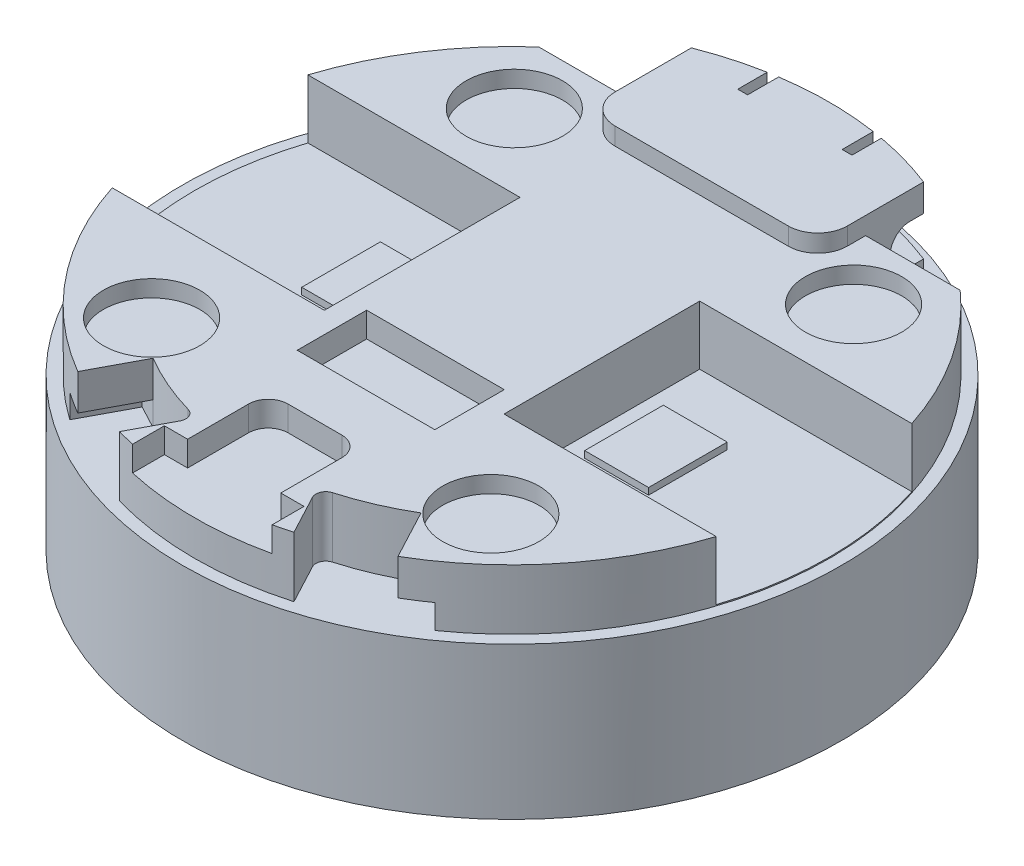
from build123d import *

# Parameters (mm, degrees)
SKETCH1_R           = 33.52
BOSS_EXTRUDE1_DEPTH = 9
SKETCH2_R           = 32.29
BOSS_EXTRUDE2_DEPTH = 6.12
CUT_EXTRUDE1_START  = -6
CUT_EXTRUDE1_DEPTH  = 6
SKETCH10_R          = 2
CUT_EXTRUDE2_DEPTH  = 59.369629946
SKETCH23_W          = 6.054526745
SKETCH23_H          = 4
CUT_EXTRUDE3_DEPTH  = 59.369629972
BOSS_EXTRUDE4_DEPTH = 1.78
CUT_EXTRUDE5_START  = -6
CUT_EXTRUDE5_DEPTH  = 6
CUT_EXTRUDE6_START  = -2.54
SKETCH26_W          = 14
SKETCH26_H          = 4.621469047
CUT_EXTRUDE6_DEPTH  = 2.54
CUT_EXTRUDE7_START  = -6.12
CUT_EXTRUDE7_DEPTH  = 6.12
SKETCH26_7_R        = 4.9
CUT_EXTRUDE8_DEPTH  = 1.7
SKETCH37_W          = 5.66557495
SKETCH37_H          = 2.46
CUT_EXTRUDE13_DEPTH = 2.7
SKETCH30_W          = 5.66557495
SKETCH30_H          = 2.46
CUT_EXTRUDE14_DEPTH = 2.7
SKETCH40_W          = 6.5
SKETCH40_H          = 8
BOSS_EXTRUDE5_DEPTH = 0.68
CUT_EXTRUDE15_START = -4.1
CUT_EXTRUDE15_DEPTH = 4.1
BOSS_EXTRUDE6_START = 6.44
SKETCH41_R          = 33.52
BOSS_EXTRUDE6_DEPTH = 6.44
SKETCH43_W          = 14
SKETCH43_H          = 2.54
CUT_EXTRUDE16_DEPTH = 2.44
FILLET1_R           = 1
FILLET2_R           = 1


with BuildPart() as part:
    # Sketch1 → Boss-Extrude1 (new body)
    with BuildSketch(Plane(origin=(0, 0, 0), x_dir=(1, 0, 0), z_dir=(0, 1, 0))):
        with Locations(Location((0, 0, 0), (0, 0, 270))):
            Circle(SKETCH1_R)
    extrude(amount=BOSS_EXTRUDE1_DEPTH)

    # Sketch2 → Boss-Extrude2 (add)
    with BuildSketch(Plane(origin=(0, 9, 0), x_dir=(1, 0, 0), z_dir=(0, 1, 0))):
        with Locations(Location((0, 0, 0), (0, 0, 270))):
            Circle(SKETCH2_R)
    extrude(amount=BOSS_EXTRUDE2_DEPTH)

    # Sketch3 → Cut-Extrude1 (cut)
    with BuildSketch(Plane(origin=(0, 15.12, 0), x_dir=(1, 0, 0), z_dir=(0, 1, 0)).offset(CUT_EXTRUDE1_START)):
        with BuildLine():
            Line((-11.81, 24.153658108), (-11.81, 30.052753618))
            ThreePointArc((-11.81, 30.052753618), (-16.879698811, 27.5267119), (-21.43, 24.153658108))
            Line((-21.43, 24.153658108), (-11.81, 24.153658108))
        make_face()
        with BuildLine():
            ThreePointArc((21.43, 24.153658108), (16.879698811, 27.5267119), (11.81, 30.052753618))
            Line((11.81, 30.052753618), (11.81, 24.153658108))
            Line((11.81, 24.153658108), (21.43, 24.153658108))
        make_face()
    extrude(amount=CUT_EXTRUDE1_DEPTH, mode=Mode.SUBTRACT)

    # Sketch10 → Cut-Extrude2 (cut, through all)
    with BuildSketch(Plane.ZY.offset(11.81)):
        with Locations(Location((-28.653658108, 12.12, 0), (0, 0, 134.390731556))):
            Circle(SKETCH10_R)
    extrude(amount=-CUT_EXTRUDE2_DEPTH, mode=Mode.SUBTRACT)

    # Sketch23 → Cut-Extrude3 (cut, through all)
    with BuildSketch(Plane.ZY.offset(11.81)):
        with Locations((-31.680921481, 12.12)):
            Rectangle(SKETCH23_W, SKETCH23_H)
    extrude(amount=-CUT_EXTRUDE3_DEPTH, mode=Mode.SUBTRACT)

    # Sketch24 → Boss-Extrude4 (add)
    with BuildSketch(Plane(origin=(0, 15.12, 0), x_dir=(1, 0, 0), z_dir=(0, 1, 0))):
        with BuildLine():
            ThreePointArc((0, 32.29), (-6.010020203, 31.725758575), (-11.81, 30.052753618))
            Line((-11.81, 30.052753618), (-11.81, 24.153658108))
            Line((-11.81, 24.153658108), (-11.81, 22.29))
            ThreePointArc((-11.81, 22.29), (-10.931320344, 20.168679656), (-8.81, 19.29))
            Line((-8.81, 19.29), (0, 19.29))
            Line((0, 19.29), (0, 32.29))
        make_face()
        with BuildLine():
            ThreePointArc((11.81, 30.052753618), (6.010020203, 31.725758575), (0, 32.29))
            Line((0, 32.29), (0, 19.29))
            Line((0, 19.29), (8.81, 19.29))
            ThreePointArc((8.81, 19.29), (10.931320344, 20.168679656), (11.81, 22.29))
            Line((11.81, 22.29), (11.81, 24.153658108))
            Line((11.81, 24.153658108), (11.81, 30.052753618))
        make_face()
    extrude(amount=BOSS_EXTRUDE4_DEPTH)

    # Sketch26<4> → Cut-Extrude5 (cut)
    with BuildSketch(Plane(origin=(0, 15.12, 0), x_dir=(1, 0, 0), z_dir=(0, 1, 0)).offset(CUT_EXTRUDE5_START)):
        with BuildLine():
            ThreePointArc((30.718749975, -9.95), (32.29, 0), (30.718749975, 9.95))
            Line((30.718749975, 9.95), (9.138749975, 9.95))
            Line((9.138749975, 9.95), (9.138749975, -9.95))
            Line((9.138749975, -9.95), (30.718749975, -9.95))
        make_face()
    cut_extrude5 = extrude(amount=CUT_EXTRUDE5_DEPTH, mode=Mode.SUBTRACT)

    # Sketch26 → Cut-Extrude6 (cut)
    with BuildSketch(Plane(origin=(0, 15.12, 0), x_dir=(1, 0, 0), z_dir=(0, 1, 0)).offset(CUT_EXTRUDE6_START)):
        with BuildLine():
            ThreePointArc((-7.1, -31.499747618), (0, -32.29), (7.1, -31.499747618))
            Line((7.1, -31.499747618), (7.1, -28.259676136))
            Line((7.1, -28.259676136), (4.74, -28.259676136))
            Line((4.74, -28.259676136), (4.74, -26.204757202))
            Line((4.74, -26.204757202), (4.74, -22.05))
            ThreePointArc((4.74, -22.05), (4.154213562, -20.635786438), (2.74, -20.05))
            Line((2.74, -20.05), (-2.74, -20.05))
            ThreePointArc((-2.74, -20.05), (-4.154213562, -20.635786438), (-4.74, -22.05))
            Line((-4.74, -22.05), (-4.74, -26.204757202))
            Line((-4.74, -26.204757202), (-4.74, -28.259676136))
            Line((-4.74, -28.259676136), (-7.1, -28.259676136))
            Line((-7.1, -28.259676136), (-7.1, -31.499747618))
        make_face()
        with Locations((0, -12.539265477)):
            Rectangle(SKETCH26_W, SKETCH26_H)
    extrude(amount=CUT_EXTRUDE6_DEPTH, mode=Mode.SUBTRACT)

    # Sketch28 → Cut-Extrude7 (cut)
    with BuildSketch(Plane(origin=(0, 15.12, 0), x_dir=(1, 0, 0), z_dir=(0, 1, 0)).offset(CUT_EXTRUDE7_START)):
        with BuildLine():
            ThreePointArc((-6.138643472, -25.91281452), (-9.99763899, -24.682060583), (-13.62533551, -22.880278238))
            Line((-13.62533551, -22.880278238), (-16.282957683, -27.883855348))
            ThreePointArc((-16.282957683, -27.883855348), (-12.673955944, -29.698736349), (-8.866590913, -31.048794913))
            Line((-8.866590913, -31.048794913), (-6.138643472, -25.91281452))
        make_face()
        with BuildLine():
            ThreePointArc((13.62533551, -22.880278238), (9.99763899, -24.682060583), (6.138643472, -25.91281452))
            Line((6.138643472, -25.91281452), (8.866590913, -31.048794913))
            ThreePointArc((8.866590913, -31.048794913), (12.673955944, -29.698736349), (16.282957683, -27.883855348))
            Line((16.282957683, -27.883855348), (13.62533551, -22.880278238))
        make_face()
    extrude(amount=CUT_EXTRUDE7_DEPTH, mode=Mode.SUBTRACT)

    # Sketch26<7> → Cut-Extrude8 (cut)
    with BuildSketch(Plane(origin=(0, 15.12, 0), x_dir=(1, 0, 0), z_dir=(0, 1, 0))):
        with Locations(Location((17.253376134, 17.489232673, 0), (0, 0, 270))):
            Circle(SKETCH26_7_R)
        with Locations(Location((17.253376134, -19.410767327, 0), (0, 0, 270))):
            Circle(SKETCH26_7_R)
        with Locations(Location((-17.253376134, -19.410767327, 0), (0, 0, 270))):
            Circle(SKETCH26_7_R)
        with Locations(Location((-17.253376134, 17.489232673, 0), (0, 0, 270))):
            Circle(SKETCH26_7_R)
    extrude(amount=-CUT_EXTRUDE8_DEPTH, mode=Mode.SUBTRACT)

    # Sketch37 → Cut-Extrude13 (cut)
    with BuildSketch(Plane(origin=(1.148573691, 0, -0.610058532), x_dir=(0.4690825196866177, 0, 0.8831543408286312), z_dir=(-0.8831543408286312, 0, 0.4690825196866177))):
        with Locations((29.431011233, 10.23)):
            Rectangle(SKETCH37_W, SKETCH37_H)
    extrude(amount=-CUT_EXTRUDE13_DEPTH, mode=Mode.SUBTRACT)

    # Sketch30 → Cut-Extrude14 (cut)
    with BuildSketch(Plane(origin=(-1.148573691, 0, -0.610058532), x_dir=(0.4690825196866177, 0, -0.8831543408286312), z_dir=(0.8831543408286312, 0, 0.4690825196866177))):
        with Locations((-29.431011233, 10.23)):
            Rectangle(SKETCH30_W, SKETCH30_H)
    extrude(amount=-CUT_EXTRUDE14_DEPTH, mode=Mode.SUBTRACT)

    # Sketch40 → Boss-Extrude5 (add)
    with BuildSketch(Plane(origin=(0, 9.12, 0), x_dir=(1, 0, 0), z_dir=(0, 1, 0))):
        with Locations((14.388749975, 0.25)):
            Rectangle(SKETCH40_W, SKETCH40_H)
    boss_extrude5 = extrude(amount=BOSS_EXTRUDE5_DEPTH)

    # Sketch31 → Cut-Extrude15 (cut)
    with BuildSketch(Plane(origin=(0, 16.9, 0), x_dir=(1, 0, 0), z_dir=(0, 1, 0)).offset(CUT_EXTRUDE15_START)):
        with BuildLine():
            ThreePointArc((-4.81, 31.929735358), (-5.310654422, 31.850291201), (-5.81, 31.76299734))
            Line((-5.81, 31.76299734), (-5.81, 28.77))
            Line((-5.81, 28.77), (-4.81, 28.77))
            Line((-4.81, 28.77), (-4.81, 31.929735358))
        make_face()
        with BuildLine():
            ThreePointArc((5.81, 31.76299734), (5.310654422, 31.850291201), (4.81, 31.929735358))
            Line((4.81, 31.929735358), (4.81, 28.77))
            Line((4.81, 28.77), (5.81, 28.77))
            Line((5.81, 28.77), (5.81, 31.76299734))
        make_face()
    extrude(amount=CUT_EXTRUDE15_DEPTH, mode=Mode.SUBTRACT)

    # Sketch41 → Boss-Extrude6 (add)
    with BuildSketch(Plane.XZ.offset(BOSS_EXTRUDE6_START)):
        with Locations(Location((0, 0, 0), (0, 0, 270))):
            Circle(SKETCH41_R)
    extrude(amount=-BOSS_EXTRUDE6_DEPTH)

    # Sketch43 → Cut-Extrude16 (cut)
    with BuildSketch(Plane.XY.offset(10.228530953)):
        with Locations((0, 13.85)):
            Rectangle(SKETCH43_W, SKETCH43_H)
    extrude(amount=-CUT_EXTRUDE16_DEPTH, mode=Mode.SUBTRACT)

    # Mirror1: Cut-Extrude5 across plane
    add(cut_extrude5.mirror(Plane.ZY), mode=Mode.SUBTRACT)

    # Mirror2: Boss-Extrude5 across plane
    add(boss_extrude5.mirror(Plane.ZY))

    # Fillet1
    fillet1_edges = [part.edges().sort_by_distance(p)[0] for p in [
        (6.138643472, 12.06, 25.91281452),
    ]]
    fillet(fillet1_edges, radius=FILLET1_R)

    # Fillet2
    fillet2_edges = [part.edges().sort_by_distance(p)[0] for p in [
        (-6.138643472, 12.06, 25.91281452),
    ]]
    fillet(fillet2_edges, radius=FILLET2_R)


solid = part.part
